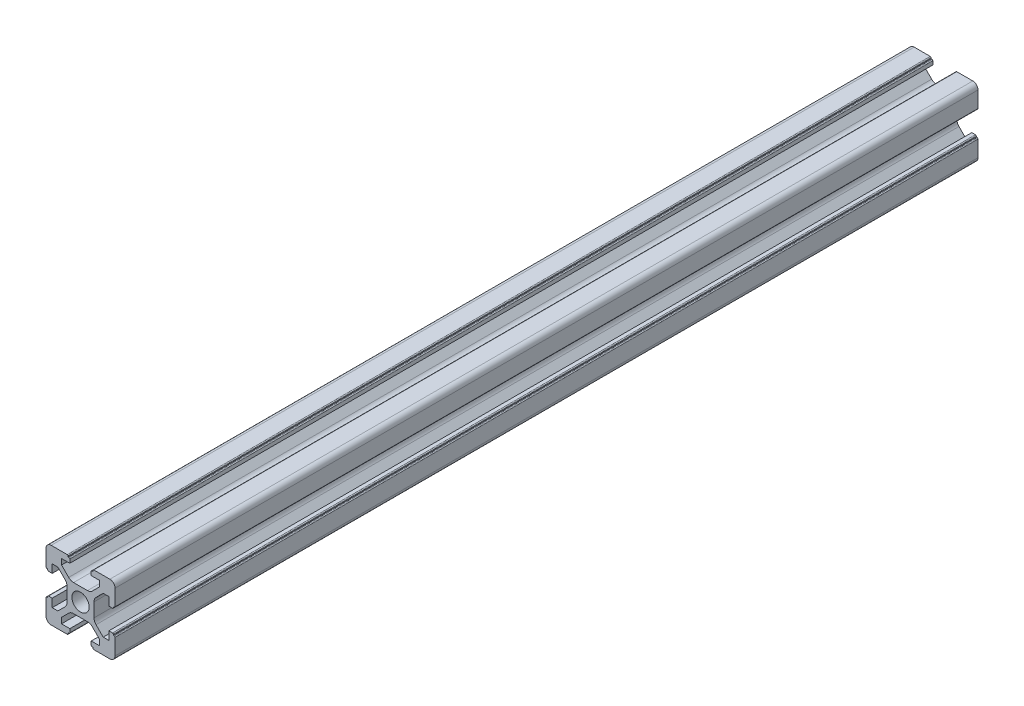
from build123d import *

# Parameters (mm, degrees)
SKETCH1_R           = 2.5
BOSS_EXTRUDE1_DEPTH = 250


with BuildPart() as part:
    # Sketch1 → Boss-Extrude1 (new body)
    with BuildSketch(Plane.XY):
        with BuildLine():
            Line((-8.5, 10), (-3.85, 10))
            ThreePointArc((-3.85, 10), (-3.673223305, 9.926776695), (-3.6, 9.75))
            Line((-3.6, 9.75), (-3.6, 9.5))
            Line((-3.6, 9.5), (-3.35, 9.5))
            ThreePointArc((-3.35, 9.5), (-3.173223305, 9.426776695), (-3.1, 9.25))
            Line((-3.1, 9.25), (-3.1, 8.2))
            Line((-3.1, 8.2), (-5.5, 8.2))
            Line((-5.5, 8.2), (-5.5, 6.560660172))
            Line((-5.5, 6.560660172), (-3.425126266, 4.485786438))
            ThreePointArc((-3.425126266, 4.485786438), (-2.776279568, 4.052240935), (-2.010912703, 3.9))
            Line((-2.010912703, 3.9), (2.010912703, 3.9))
            ThreePointArc((2.010912703, 3.9), (2.776279568, 4.052240935), (3.425126266, 4.485786438))
            Line((3.425126266, 4.485786438), (5.5, 6.560660172))
            Line((5.5, 6.560660172), (5.5, 8.2))
            Line((5.5, 8.2), (3.1, 8.2))
            Line((3.1, 8.2), (3.1, 9.25))
            ThreePointArc((3.1, 9.25), (3.173223305, 9.426776695), (3.35, 9.5))
            Line((3.35, 9.5), (3.6, 9.5))
            Line((3.6, 9.5), (3.6, 9.75))
            ThreePointArc((3.6, 9.75), (3.673223305, 9.926776695), (3.85, 10))
            Line((3.85, 10), (8.5, 10))
            ThreePointArc((8.5, 10), (9.560660172, 9.560660172), (10, 8.5))
            Line((10, 8.5), (10, 3.85))
            ThreePointArc((10, 3.85), (9.926776695, 3.673223305), (9.75, 3.6))
            Line((9.75, 3.6), (9.5, 3.6))
            Line((9.5, 3.6), (9.5, 3.35))
            ThreePointArc((9.5, 3.35), (9.426776695, 3.173223305), (9.25, 3.1))
            Line((9.25, 3.1), (8.2, 3.1))
            Line((8.2, 3.1), (8.2, 5.5))
            Line((8.2, 5.5), (6.560660172, 5.5))
            Line((6.560660172, 5.5), (4.485786438, 3.425126266))
            ThreePointArc((4.485786438, 3.425126266), (4.052240935, 2.776279568), (3.9, 2.010912703))
            Line((3.9, 2.010912703), (3.9, -2.010912703))
            ThreePointArc((3.9, -2.010912703), (4.052240935, -2.776279568), (4.485786438, -3.425126266))
            Line((4.485786438, -3.425126266), (6.560660172, -5.5))
            Line((6.560660172, -5.5), (8.2, -5.5))
            Line((8.2, -5.5), (8.2, -3.1))
            Line((8.2, -3.1), (9.25, -3.1))
            ThreePointArc((9.25, -3.1), (9.426776695, -3.173223305), (9.5, -3.35))
            Line((9.5, -3.35), (9.5, -3.6))
            Line((9.5, -3.6), (9.75, -3.6))
            ThreePointArc((9.75, -3.6), (9.926776695, -3.673223305), (10, -3.85))
            Line((10, -3.85), (10, -8.5))
            ThreePointArc((10, -8.5), (9.560660172, -9.560660172), (8.5, -10))
            Line((8.5, -10), (3.85, -10))
            ThreePointArc((3.85, -10), (3.673223305, -9.926776695), (3.6, -9.75))
            Line((3.6, -9.75), (3.6, -9.5))
            Line((3.6, -9.5), (3.35, -9.5))
            ThreePointArc((3.35, -9.5), (3.173223305, -9.426776695), (3.1, -9.25))
            Line((3.1, -9.25), (3.1, -8.2))
            Line((3.1, -8.2), (5.5, -8.2))
            Line((5.5, -8.2), (5.5, -6.560660172))
            Line((5.5, -6.560660172), (3.425126266, -4.485786438))
            ThreePointArc((3.425126266, -4.485786438), (2.776279568, -4.052240935), (2.010912703, -3.9))
            Line((2.010912703, -3.9), (-2.010912703, -3.9))
            ThreePointArc((-2.010912703, -3.9), (-2.776279568, -4.052240935), (-3.425126266, -4.485786438))
            Line((-3.425126266, -4.485786438), (-5.5, -6.560660172))
            Line((-5.5, -6.560660172), (-5.5, -8.2))
            Line((-5.5, -8.2), (-3.1, -8.2))
            Line((-3.1, -8.2), (-3.1, -9.25))
            ThreePointArc((-3.1, -9.25), (-3.173223305, -9.426776695), (-3.35, -9.5))
            Line((-3.35, -9.5), (-3.6, -9.5))
            Line((-3.6, -9.5), (-3.6, -9.75))
            ThreePointArc((-3.6, -9.75), (-3.673223305, -9.926776695), (-3.85, -10))
            Line((-3.85, -10), (-8.5, -10))
            ThreePointArc((-8.5, -10), (-9.560660172, -9.560660172), (-10, -8.5))
            Line((-10, -8.5), (-10, -3.85))
            ThreePointArc((-10, -3.85), (-9.926776695, -3.673223305), (-9.75, -3.6))
            Line((-9.75, -3.6), (-9.5, -3.6))
            Line((-9.5, -3.6), (-9.5, -3.35))
            ThreePointArc((-9.5, -3.35), (-9.426776695, -3.173223305), (-9.25, -3.1))
            Line((-9.25, -3.1), (-8.2, -3.1))
            Line((-8.2, -3.1), (-8.2, -5.5))
            Line((-8.2, -5.5), (-6.560660172, -5.5))
            Line((-6.560660172, -5.5), (-4.485786438, -3.425126266))
            ThreePointArc((-4.485786438, -3.425126266), (-4.052240935, -2.776279568), (-3.9, -2.010912703))
            Line((-3.9, -2.010912703), (-3.9, 2.010912703))
            ThreePointArc((-3.9, 2.010912703), (-4.052240935, 2.776279568), (-4.485786438, 3.425126266))
            Line((-4.485786438, 3.425126266), (-6.560660172, 5.5))
            Line((-6.560660172, 5.5), (-8.2, 5.5))
            Line((-8.2, 5.5), (-8.2, 3.1))
            Line((-8.2, 3.1), (-9.25, 3.1))
            ThreePointArc((-9.25, 3.1), (-9.426776695, 3.173223305), (-9.5, 3.35))
            Line((-9.5, 3.35), (-9.5, 3.6))
            Line((-9.5, 3.6), (-9.75, 3.6))
            ThreePointArc((-9.75, 3.6), (-9.926776695, 3.673223305), (-10, 3.85))
            Line((-10, 3.85), (-10, 8.5))
            ThreePointArc((-10, 8.5), (-9.560660172, 9.560660172), (-8.5, 10))
        make_face()
        Circle(SKETCH1_R, mode=Mode.SUBTRACT)
    extrude(amount=BOSS_EXTRUDE1_DEPTH)


solid = part.part
